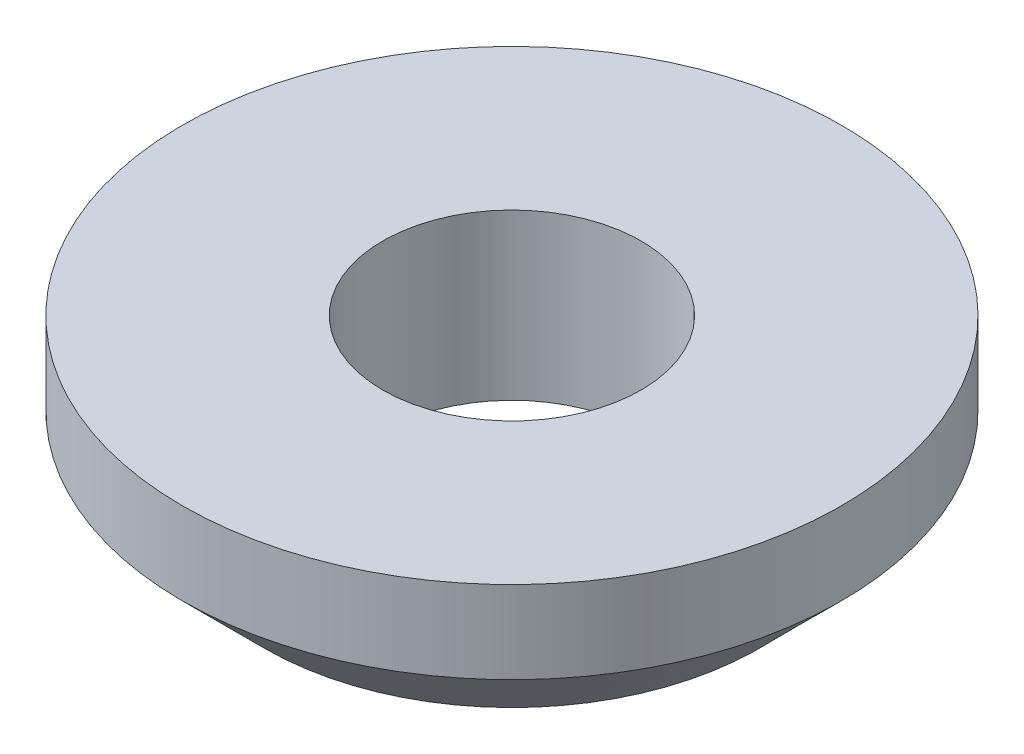
from build123d import *

# Parameters (mm, degrees)
SKETCH1_R           = 6.35
SKETCH1_R_2         = 2.4892
BOSS_EXTRUDE1_DEPTH = 1.5875
CHAMFER1_SIZE       = 1.5875


with BuildPart() as part:
    # Sketch1 → Boss-Extrude1 (new, symmetric)
    with BuildSketch(Plane(origin=(0, 0, 0), x_dir=(1, 0, 0), z_dir=(0, 1, 0))):
        with Locations(Location((0, 0, 0), (0, 0, 270))):
            Circle(SKETCH1_R)
        with Locations(Location((0, 0, 0), (0, 0, 270))):
            Circle(SKETCH1_R_2, mode=Mode.SUBTRACT)
    extrude(amount=BOSS_EXTRUDE1_DEPTH, both=True)

    # Chamfer1
    chamfer1_edges = [part.edges().sort_by_distance(p)[0] for p in [
        (0, -1.5875, -6.35),
    ]]
    chamfer(chamfer1_edges, length=CHAMFER1_SIZE)


solid = part.part
